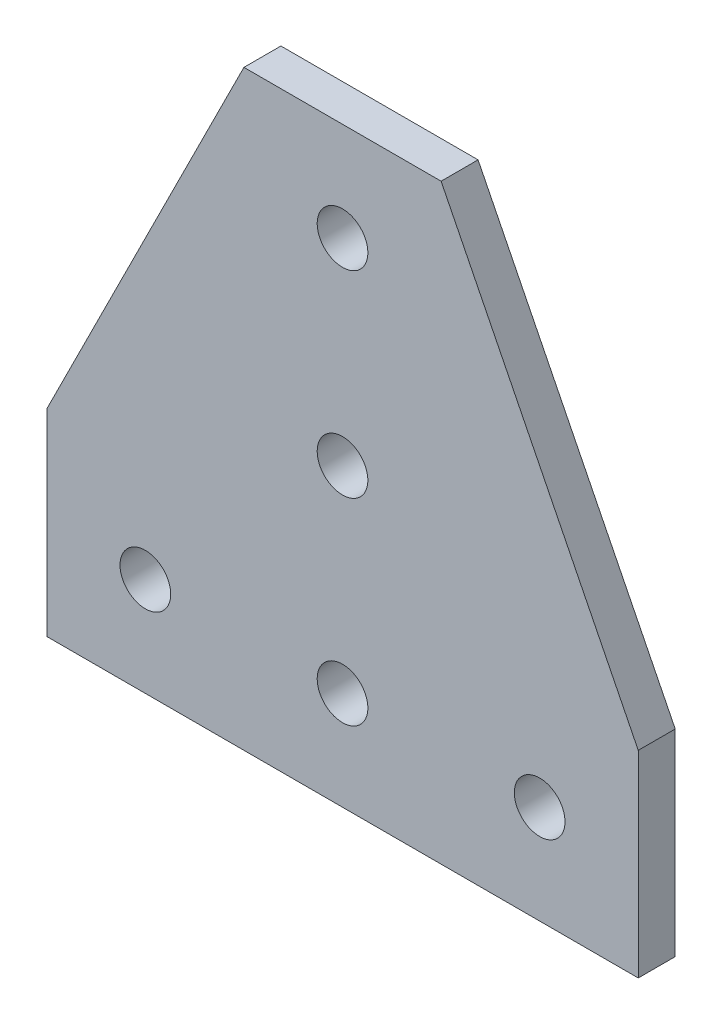
from build123d import *

# Parameters (mm, degrees)
EXTRUDE1_DEPTH   = 4.7625
SKETCH3_R        = 3.2639
SINGLE_TEE_DEPTH = 82.459016728


with BuildPart() as part:
    # Sketch1 → Extrude1 (new body)
    with BuildSketch(Plane.XY):
        Polygon((12.7, 25.4), (25.4, 25.4), (25.4, -50.8), (-12.7, -50.8), (-12.7, -25.4), align=None)
    extrude(amount=-EXTRUDE1_DEPTH)

    # Mirror1: part across plane


with BuildPart() as part_1:
    add(part.part)
    add(part.part.mirror(Plane(origin=(25.4, 25.4, -4.7625), x_dir=(0, 0, 1), z_dir=(1, 0, 0))))

    # Sketch3 → single tee (cut, through all)
    with BuildSketch(Plane(origin=(0, 0, -4.7625), x_dir=(-1, 0, 0), z_dir=(0, 0, -1))):
        with Locations((-25.4, -38.1)):
            Circle(SKETCH3_R)
        with Locations((-25.4, -12.7)):
            Circle(SKETCH3_R)
        with Locations((-25.4, 12.7)):
            Circle(SKETCH3_R)
        with Locations((-50.8, -38.1)):
            Circle(SKETCH3_R)
        with Locations((0, -38.1)):
            Circle(SKETCH3_R)
    extrude(amount=-SINGLE_TEE_DEPTH, mode=Mode.SUBTRACT)


solid = part_1.part
